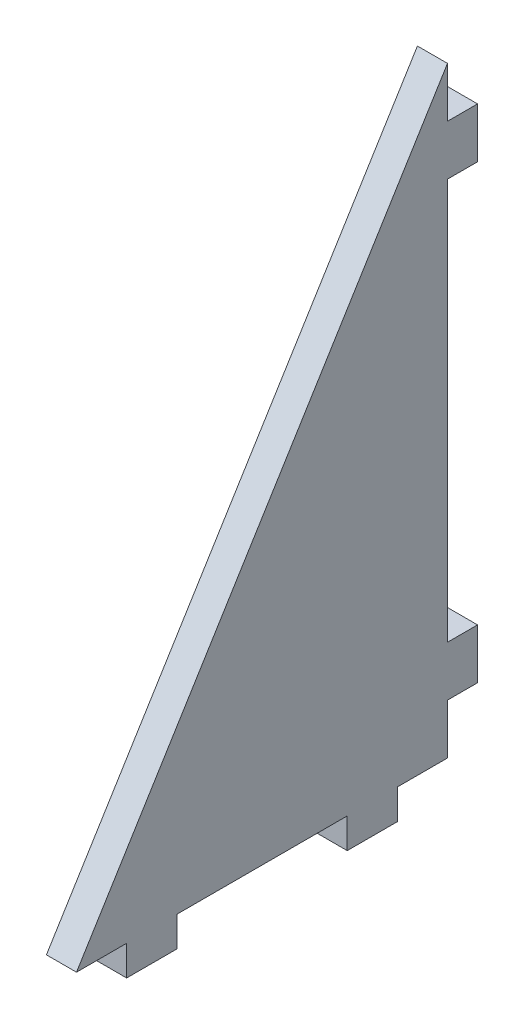
from build123d import *

# Parameters (mm, degrees)
SKETCH1_W           = 37
SKETCH1_H           = 60
BOSS_EXTRUDE1_DEPTH = 3
CUT_EXTRUDE1_DEPTH  = 3
SKETCH3_W           = 3
SKETCH3_H           = 5
BOSS_EXTRUDE2_DEPTH = 3
SKETCH4_W           = 3
SKETCH4_H           = 5
BOSS_EXTRUDE3_DEPTH = 3


with BuildPart() as part:
    # Sketch1 → Boss-Extrude1 (new body)
    with BuildSketch(Plane(origin=(0, 0, 0), x_dir=(0, 0, -1), z_dir=(1, 0, 0))):
        Rectangle(SKETCH1_W, SKETCH1_H)
    extrude(amount=BOSS_EXTRUDE1_DEPTH)

    # Sketch2 → Cut-Extrude1 (cut)
    with BuildSketch(Plane(origin=(3, 0, 0), x_dir=(0, 0, -1), z_dir=(1, 0, 0))):
        Polygon((-18.5, -30), (18.5, 30), (-18.5, 30), align=None)
    extrude(amount=-CUT_EXTRUDE1_DEPTH, mode=Mode.SUBTRACT)

    # Sketch3 → Boss-Extrude2 (add)
    with BuildSketch(Plane.XZ.offset(30)):
        with Locations((1.5, 11)):
            Rectangle(SKETCH3_W, SKETCH3_H)
        with Locations((1.5, -11)):
            Rectangle(SKETCH3_W, SKETCH3_H)
    extrude(amount=BOSS_EXTRUDE2_DEPTH)

    # Sketch4 → Boss-Extrude3 (add)
    with BuildSketch(Plane(origin=(0, 0, -18.5), x_dir=(-1, 0, 0), z_dir=(0, 0, -1))):
        with Locations((-1.5, -22.5)):
            Rectangle(SKETCH4_W, SKETCH4_H)
        with Locations((-1.5, 22.5)):
            Rectangle(SKETCH4_W, SKETCH4_H)
    extrude(amount=BOSS_EXTRUDE3_DEPTH)


solid = part.part
